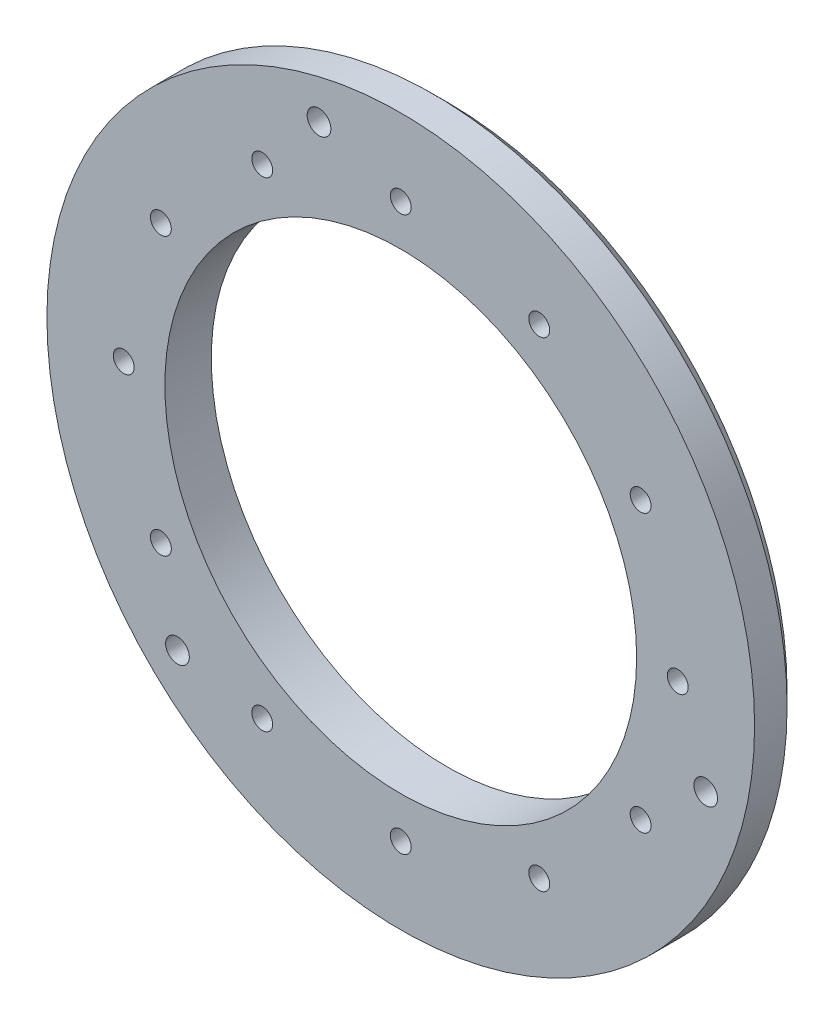
from build123d import *

# Parameters (mm, degrees)
ESQUISSE2_R                                       = 76.2
ESQUISSE2_R_2                                     = 50.8
BOSS_EXTRU_1_DEPTH                                = 10
CHANFREIN1_SIZE                                   = 3
D_GAGEMENT_81_D                                   = 4.4958
FRAISAGE_POUR_VIS_T_TE_FRAIS_E_BOMB_E_D           = 5.1054
FRAISAGE_POUR_VIS_T_TE_FRAIS_E_BOMB_E_CSINK_D     = 9.779
FRAISAGE_POUR_VIS_T_TE_FRAIS_E_BOMB_E_CSINK_ANGLE = 82


with BuildPart() as part:
    # Esquisse2 → Boss.-Extru.1 (new body)
    with BuildSketch(Plane.XY):
        Circle(ESQUISSE2_R)
        Circle(ESQUISSE2_R_2, mode=Mode.SUBTRACT)
    extrude(amount=BOSS_EXTRU_1_DEPTH)

    # Chanfrein1
    chanfrein1_edges = [part.edges().sort_by_distance(p)[0] for p in [
        (-76.2, 0, 0),
    ]]
    chamfer(chanfrein1_edges, length=CHANFREIN1_SIZE)

    # Dégagement #81 (through all)
    with Locations(Plane(origin=(0, 0, 0), x_dir=(-1, 0, 0), z_dir=(0, 0, -1))):
        with Locations((0, 59.65), (51.658415336, 29.825), (29.825, 51.658415336), (59.65, 0), (51.658415336, -29.825), (29.825, -51.658415336), (0, -59.65), (-29.825, -51.658415336), (-51.658415336, -29.825), (-59.65, 0), (-51.658415336, 29.825), (-29.825, 51.658415336)):
            Hole(D_GAGEMENT_81_D / 2)

    # Fraisage pour vis à tête fraisée bombée #101 (through all)
    with Locations(Plane(origin=(0, 0, 0), x_dir=(-1, 0, 0), z_dir=(0, 0, -1))):
        with Locations((48.083261121, -48.083261121), (-65.682956188, -17.599695067), (17.599695067, 65.682956188)):
            CounterSinkHole(FRAISAGE_POUR_VIS_T_TE_FRAIS_E_BOMB_E_D / 2, FRAISAGE_POUR_VIS_T_TE_FRAIS_E_BOMB_E_CSINK_D / 2, counter_sink_angle=FRAISAGE_POUR_VIS_T_TE_FRAIS_E_BOMB_E_CSINK_ANGLE)


solid = part.part
